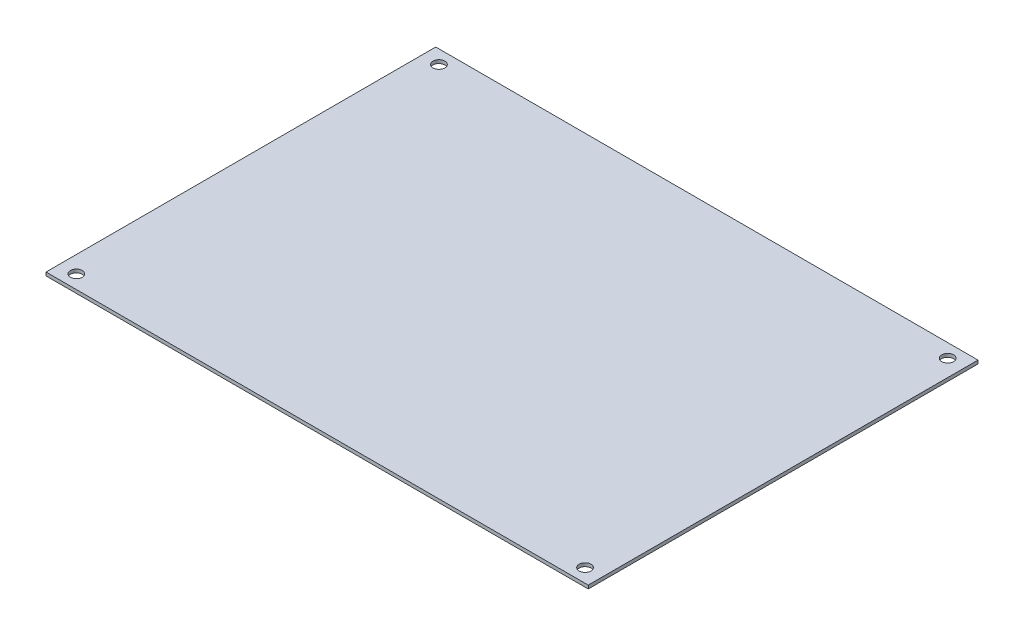
from build123d import *

# Parameters (mm, degrees)
SKETCH1_W           = 160
SKETCH1_H           = 115
BOSS_EXTRUDE1_DEPTH = 1
SKETCH2_R           = 1.75
CUT_EXTRUDE1_DEPTH  = 110.70671941


with BuildPart() as part:
    # Sketch1 → Boss-Extrude1 (new body)
    with BuildSketch(Plane(origin=(0, 0, 0), x_dir=(1, 0, 0), z_dir=(0, 1, 0))):
        with Locations((13.099935112, 0.525566485)):
            Rectangle(SKETCH1_W, SKETCH1_H)
    extrude(amount=BOSS_EXTRUDE1_DEPTH)

    # Sketch2 → Cut-Extrude1 (cut, through all)
    with BuildSketch(Plane(origin=(0, 1, 0), x_dir=(1, 0, 0), z_dir=(0, 1, 0))):
        with Locations(Location((-61.955064888, -52.974433515, 0), (0, 0, 270))):
            Circle(SKETCH2_R)
        with Locations(Location((-61.955064888, 54.025566485, 0), (0, 0, 270))):
            Circle(SKETCH2_R)
        with Locations(Location((88.154935112, -52.974433515, 0), (0, 0, 270))):
            Circle(SKETCH2_R)
        with Locations(Location((88.154935112, 54.025566485, 0), (0, 0, 270))):
            Circle(SKETCH2_R)
    extrude(amount=-CUT_EXTRUDE1_DEPTH, mode=Mode.SUBTRACT)


solid = part.part
